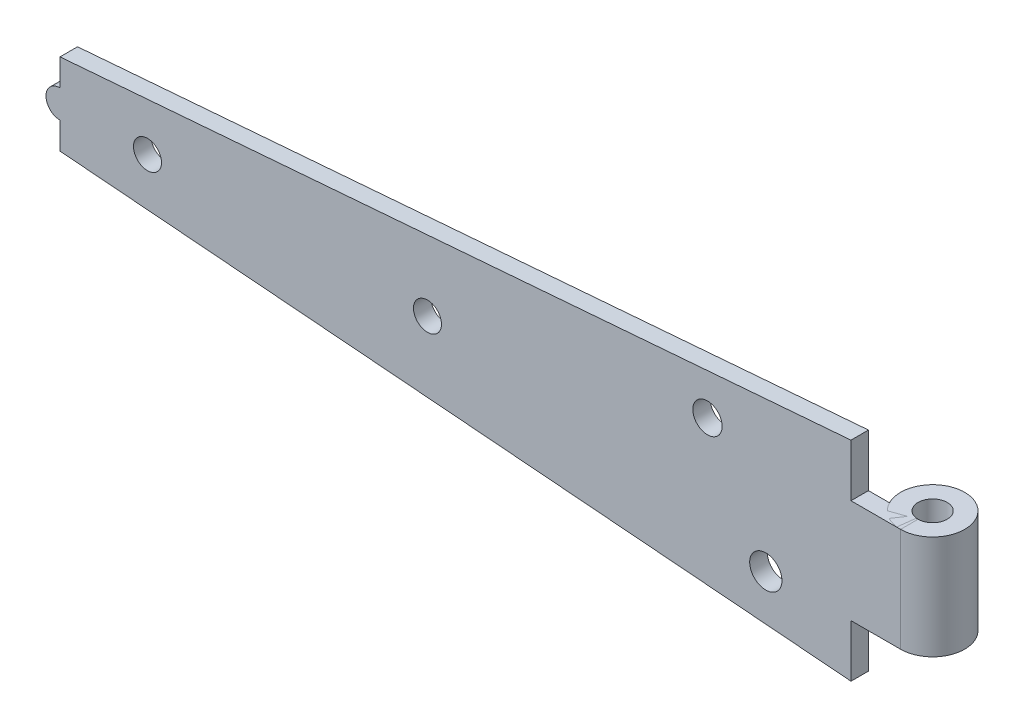
from build123d import *

# Parameters (mm, degrees)
SKETCH1_R           = 2.4
SKETCH1_R_2         = 2.515000774
SKETCH1_R_3         = 2.764002303
BOSS_EXTRUDE1_DEPTH = 3
BOSS_EXTRUDE2_START = 9
SKETCH2_R           = 5.5
BOSS_EXTRUDE2_DEPTH = 17.8
SKETCH4_R           = 2.5
CUT_EXTRUDE1_DEPTH  = 143.792296711


with BuildPart() as part:
    # Sketch1 → Boss-Extrude1 (new body)
    with BuildSketch(Plane.XY):
        with BuildLine():
            Line((0, 0), (-135.6, 10.9))
            Line((-135.6, 10.9), (-135.6, 15.5))
            ThreePointArc((-135.6, 15.5), (-138, 17.9), (-135.6, 20.3))
            Line((-135.6, 20.3), (-135.6, 24.9))
            Line((-135.6, 24.9), (0, 35.8))
            Line((0, 35.8), (0, 26.8))
            Line((0, 26.8), (8.5, 26.8))
            Line((8.5, 26.8), (8.5, 9))
            Line((8.5, 9), (0, 9))
            Line((0, 9), (0, 0))
        make_face()
        with Locations((-120.6, 17.9)):
            Circle(SKETCH1_R, mode=Mode.SUBTRACT)
        with Locations((-72.6, 17.9)):
            Circle(SKETCH1_R, mode=Mode.SUBTRACT)
        with Locations((-24.6, 26.8)):
            Circle(SKETCH1_R_2, mode=Mode.SUBTRACT)
        with Locations((-14.6, 9)):
            Circle(SKETCH1_R_3, mode=Mode.SUBTRACT)
    extrude(amount=BOSS_EXTRUDE1_DEPTH)


with BuildPart() as body_2:
    # Sketch2 → Boss-Extrude2 (new body)
    with BuildSketch(Plane(origin=(0, 0, 0), x_dir=(1, 0, 0), z_dir=(0, 1, 0)).offset(BOSS_EXTRUDE2_START)):
        with Locations(Location((8.5, 2.5, 0), (0, 0, 270))):
            Circle(SKETCH2_R)
    extrude(amount=BOSS_EXTRUDE2_DEPTH)

    # Sketch4 → Cut-Extrude1 (cut, through all)
    with BuildSketch(Plane(origin=(0, 0, 0), x_dir=(1, 0, 0), z_dir=(0, 1, 0))):
        with Locations(Location((8.5, 2.5, 0), (0, 0, 270))):
            Circle(SKETCH4_R)
    extrude(amount=CUT_EXTRUDE1_DEPTH, mode=Mode.SUBTRACT)


solid = Compound([part.part, body_2.part])
